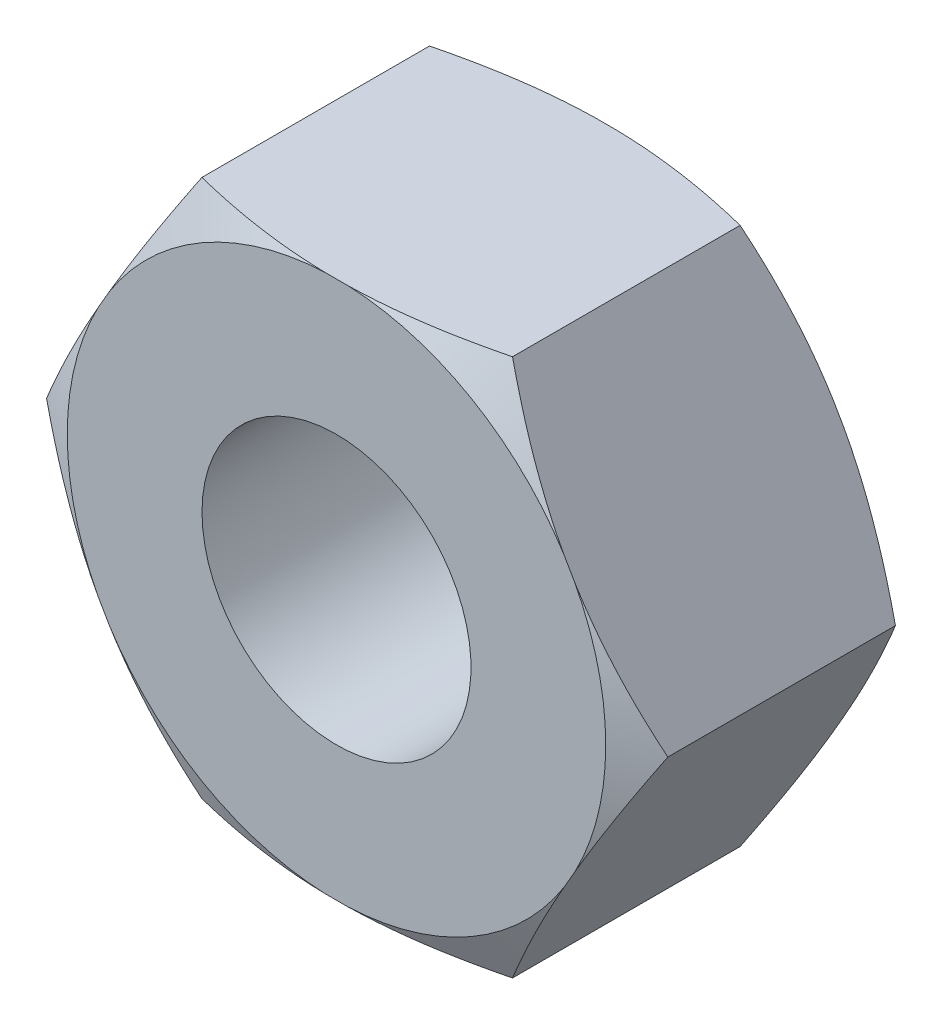
from build123d import *

# Parameters (mm, degrees)
IZIM1_R                     = 3.25
Y_KSEKLIK_EKSTR_ZYON1_DEPTH = 6.5


with BuildPart() as part:
    # Çizim1 → Yükseklik-Ekstrüzyon1 (new body)
    with BuildSketch(Plane.XY):
        Polygon((7.505553499, 0), (3.75277675, 6.5), (-3.75277675, 6.5), (-7.505553499, 0), (-3.75277675, -6.5), (3.75277675, -6.5), align=None)
        with Locations(Location((0, 0, 0), (0, 0, 180))):
            Circle(IZIM1_R, mode=Mode.SUBTRACT)
    extrude(amount=Y_KSEKLIK_EKSTR_ZYON1_DEPTH)

    # Çizim2 → Kes-Döndür1 (revolve, cut)
    with BuildSketch(Plane(origin=(0, 0, 0), x_dir=(1, 0, 0), z_dir=(0, 1, 0))):
        Polygon((-7.505553499, 0), (-6.505553499, 0), (-7.505553499, -0.5), align=None)
        Polygon((-7.505553499, -6.5), (-7.505553499, -6), (-6.505553499, -6.5), align=None)
    revolve(axis=Axis((0, 0, 0), (0, 0, 1)), mode=Mode.SUBTRACT)


solid = part.part
